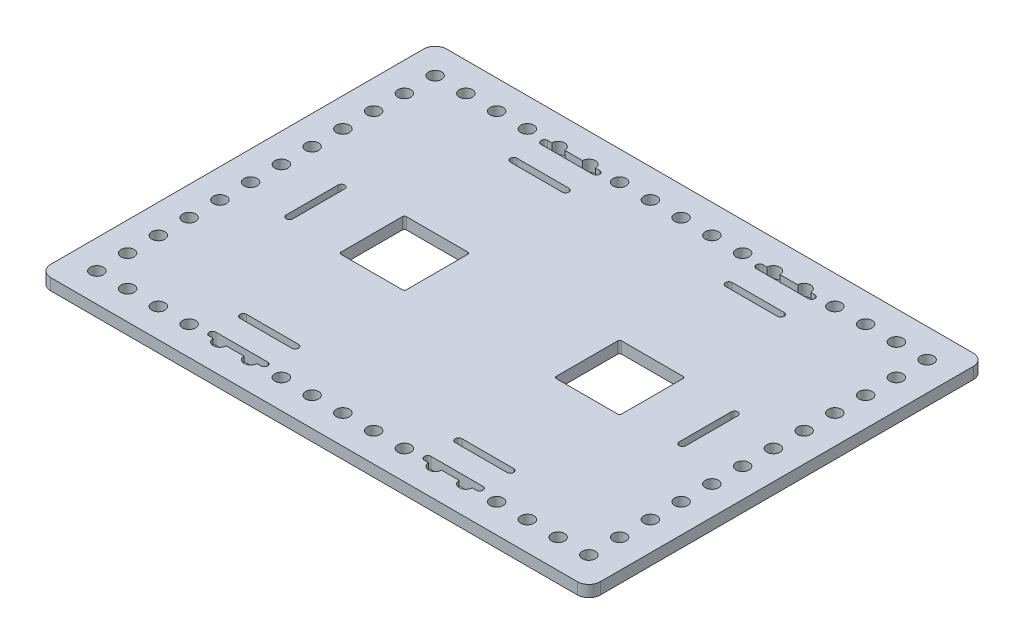
from build123d import *

# Parameters (mm, degrees)
SKETCH1_R           = 1.7
BOSS_EXTRUDE1_DEPTH = 3


with BuildPart() as part:
    # Sketch1 → Boss-Extrude1 (new body)
    with BuildSketch(Plane(origin=(0, 3, 0), x_dir=(1, 0, 0), z_dir=(0, 1, 0))):
        with BuildLine():
            Line((71.5, -48.5), (71.5, 48.5))
            ThreePointArc((71.5, 48.5), (70.621320344, 50.621320344), (68.5, 51.5))
            Line((68.5, 51.5), (-68.5, 51.5))
            ThreePointArc((-68.5, 51.5), (-70.621320344, 50.621320344), (-71.5, 48.5))
            Line((-71.5, 48.5), (-71.5, -48.5))
            ThreePointArc((-71.5, -48.5), (-70.621320344, -50.621320344), (-68.5, -51.5))
            Line((-68.5, -51.5), (68.5, -51.5))
            ThreePointArc((68.5, -51.5), (70.621320344, -50.621320344), (71.5, -48.5))
        make_face()
        with Locations(Location((-64, 44, 0), (0, 0, 90))):
            Circle(SKETCH1_R, mode=Mode.SUBTRACT)
        with Locations(Location((-64, 28, 0), (0, 0, 90))):
            Circle(SKETCH1_R, mode=Mode.SUBTRACT)
        with Locations(Location((-64, 12, 0), (0, 0, 90))):
            Circle(SKETCH1_R, mode=Mode.SUBTRACT)
        with Locations(Location((-64, -4, 0), (0, 0, 90))):
            Circle(SKETCH1_R, mode=Mode.SUBTRACT)
        with Locations(Location((-64, -20, 0), (0, 0, 90))):
            Circle(SKETCH1_R, mode=Mode.SUBTRACT)
        with Locations(Location((-64, -36, 0), (0, 0, 90))):
            Circle(SKETCH1_R, mode=Mode.SUBTRACT)
        with Locations(Location((56, -44, 0), (0, 0, 90))):
            Circle(SKETCH1_R, mode=Mode.SUBTRACT)
        with Locations(Location((40, -44, 0), (0, 0, 90))):
            Circle(SKETCH1_R, mode=Mode.SUBTRACT)
        with Locations(Location((8, -44, 0), (0, 0, 90))):
            Circle(SKETCH1_R, mode=Mode.SUBTRACT)
        with Locations(Location((-8, -44, 0), (0, 0, 90))):
            Circle(SKETCH1_R, mode=Mode.SUBTRACT)
        with Locations(Location((-40, -44, 0), (0, 0, 90))):
            Circle(SKETCH1_R, mode=Mode.SUBTRACT)
        with Locations(Location((-56, -44, 0), (0, 0, 90))):
            Circle(SKETCH1_R, mode=Mode.SUBTRACT)
        with Locations(Location((-64, -44, 0), (0, 0, 90))):
            Circle(SKETCH1_R, mode=Mode.SUBTRACT)
        with Locations(Location((-48, -44, 0), (0, 0, 90))):
            Circle(SKETCH1_R, mode=Mode.SUBTRACT)
        with Locations(Location((-16, -44, 0), (0, 0, 90))):
            Circle(SKETCH1_R, mode=Mode.SUBTRACT)
        with Locations(Location((0, -44, 0), (0, 0, 90))):
            Circle(SKETCH1_R, mode=Mode.SUBTRACT)
        with Locations(Location((16, -44, 0), (0, 0, 90))):
            Circle(SKETCH1_R, mode=Mode.SUBTRACT)
        with Locations(Location((48, -44, 0), (0, 0, 90))):
            Circle(SKETCH1_R, mode=Mode.SUBTRACT)
        with Locations(Location((64, -44, 0), (0, 0, 90))):
            Circle(SKETCH1_R, mode=Mode.SUBTRACT)
        with Locations(Location((-64, -28, 0), (0, 0, 90))):
            Circle(SKETCH1_R, mode=Mode.SUBTRACT)
        with Locations(Location((-64, -12, 0), (0, 0, 90))):
            Circle(SKETCH1_R, mode=Mode.SUBTRACT)
        with Locations(Location((-64, 4, 0), (0, 0, 90))):
            Circle(SKETCH1_R, mode=Mode.SUBTRACT)
        with Locations(Location((-64, 20, 0), (0, 0, 90))):
            Circle(SKETCH1_R, mode=Mode.SUBTRACT)
        with Locations(Location((-64, 36, 0), (0, 0, 90))):
            Circle(SKETCH1_R, mode=Mode.SUBTRACT)
        with Locations(Location((64, -20, 0), (0, 0, 90))):
            Circle(SKETCH1_R, mode=Mode.SUBTRACT)
        with Locations(Location((64, -4, 0), (0, 0, 90))):
            Circle(SKETCH1_R, mode=Mode.SUBTRACT)
        with Locations(Location((64, 12, 0), (0, 0, 90))):
            Circle(SKETCH1_R, mode=Mode.SUBTRACT)
        with Locations(Location((64, 28, 0), (0, 0, 90))):
            Circle(SKETCH1_R, mode=Mode.SUBTRACT)
        with Locations(Location((-48, 44, 0), (0, 0, 90))):
            Circle(SKETCH1_R, mode=Mode.SUBTRACT)
        with Locations(Location((-16, 44, 0), (0, 0, 90))):
            Circle(SKETCH1_R, mode=Mode.SUBTRACT)
        with Locations(Location((0, 44, 0), (0, 0, 90))):
            Circle(SKETCH1_R, mode=Mode.SUBTRACT)
        with Locations(Location((16, 44, 0), (0, 0, 90))):
            Circle(SKETCH1_R, mode=Mode.SUBTRACT)
        with Locations(Location((48, 44, 0), (0, 0, 90))):
            Circle(SKETCH1_R, mode=Mode.SUBTRACT)
        with Locations(Location((64, 44, 0), (0, 0, 90))):
            Circle(SKETCH1_R, mode=Mode.SUBTRACT)
        with Locations(Location((56, 44, 0), (0, 0, 90))):
            Circle(SKETCH1_R, mode=Mode.SUBTRACT)
        with Locations(Location((40, 44, 0), (0, 0, 90))):
            Circle(SKETCH1_R, mode=Mode.SUBTRACT)
        with Locations(Location((8, 44, 0), (0, 0, 90))):
            Circle(SKETCH1_R, mode=Mode.SUBTRACT)
        with Locations(Location((-8, 44, 0), (0, 0, 90))):
            Circle(SKETCH1_R, mode=Mode.SUBTRACT)
        with Locations(Location((-40, 44, 0), (0, 0, 90))):
            Circle(SKETCH1_R, mode=Mode.SUBTRACT)
        with Locations(Location((-56, 44, 0), (0, 0, 90))):
            Circle(SKETCH1_R, mode=Mode.SUBTRACT)
        with Locations(Location((64, 36, 0), (0, 0, 90))):
            Circle(SKETCH1_R, mode=Mode.SUBTRACT)
        with Locations(Location((64, 20, 0), (0, 0, 90))):
            Circle(SKETCH1_R, mode=Mode.SUBTRACT)
        with Locations(Location((64, 4, 0), (0, 0, 90))):
            Circle(SKETCH1_R, mode=Mode.SUBTRACT)
        with Locations(Location((64, -12, 0), (0, 0, 90))):
            Circle(SKETCH1_R, mode=Mode.SUBTRACT)
        with Locations(Location((64, -28, 0), (0, 0, 90))):
            Circle(SKETCH1_R, mode=Mode.SUBTRACT)
        with Locations(Location((64, -36, 0), (0, 0, 90))):
            Circle(SKETCH1_R, mode=Mode.SUBTRACT)
        with BuildLine():
            Line((21.25, 44.05), (22.300735453, 44.05))
            ThreePointArc((22.300735453, 44.05), (24, 45.7), (25.699264547, 44.05))
            Line((25.699264547, 44.05), (30.300735453, 44.05))
            ThreePointArc((30.300735453, 44.05), (32, 45.7), (33.699264547, 44.05))
            Line((33.699264547, 44.05), (34.75, 44.05))
            ThreePointArc((34.75, 44.05), (35.625, 43.175), (34.75, 42.3))
            Line((34.75, 42.3), (21.25, 42.3))
            ThreePointArc((21.25, 42.3), (20.375, 43.175), (21.25, 44.05))
        make_face(mode=Mode.SUBTRACT)
        with BuildLine():
            Line((22.300735453, -44.05), (21.25, -44.05))
            ThreePointArc((21.25, -44.05), (20.375, -43.175), (21.25, -42.3))
            Line((21.25, -42.3), (34.75, -42.3))
            ThreePointArc((34.75, -42.3), (35.625, -43.175), (34.75, -44.05))
            Line((34.75, -44.05), (33.699264547, -44.05))
            ThreePointArc((33.699264547, -44.05), (32, -45.7), (30.300735453, -44.05))
            Line((30.300735453, -44.05), (25.699264547, -44.05))
            ThreePointArc((25.699264547, -44.05), (24, -45.7), (22.300735453, -44.05))
        make_face(mode=Mode.SUBTRACT)
        with BuildLine():
            Line((21.25, 36.05), (34.75, 36.05))
            ThreePointArc((34.75, 36.05), (35.625, 35.175), (34.75, 34.3))
            Line((34.75, 34.3), (21.25, 34.3))
            ThreePointArc((21.25, 34.3), (20.375, 35.175), (21.25, 36.05))
        make_face(mode=Mode.SUBTRACT)
        with BuildLine():
            Line((50.25, -6.75), (50.25, 6.75))
            ThreePointArc((50.25, 6.75), (51.125, 7.625), (52, 6.75))
            Line((52, 6.75), (52, -6.75))
            ThreePointArc((52, -6.75), (51.125, -7.625), (50.25, -6.75))
        make_face(mode=Mode.SUBTRACT)
        with BuildLine():
            Line((21.25, -34.3), (34.75, -34.3))
            ThreePointArc((34.75, -34.3), (35.625, -35.175), (34.75, -36.05))
            Line((34.75, -36.05), (21.25, -36.05))
            ThreePointArc((21.25, -36.05), (20.375, -35.175), (21.25, -34.3))
        make_face(mode=Mode.SUBTRACT)
        with BuildLine():
            Line((36, -8.5), (20, -8.5))
            ThreePointArc((20, -8.5), (19.646446609, -8.353553391), (19.5, -8))
            Line((19.5, -8), (19.5, 8))
            ThreePointArc((19.5, 8), (19.646446609, 8.353553391), (20, 8.5))
            Line((20, 8.5), (36, 8.5))
            ThreePointArc((36, 8.5), (36.353553391, 8.353553391), (36.5, 8))
            Line((36.5, 8), (36.5, -8))
            ThreePointArc((36.5, -8), (36.353553391, -8.353553391), (36, -8.5))
        make_face(mode=Mode.SUBTRACT)
        with BuildLine():
            Line((-21.25, 34.3), (-34.75, 34.3))
            ThreePointArc((-34.75, 34.3), (-35.625, 35.175), (-34.75, 36.05))
            Line((-34.75, 36.05), (-21.25, 36.05))
            ThreePointArc((-21.25, 36.05), (-20.375, 35.175), (-21.25, 34.3))
        make_face(mode=Mode.SUBTRACT)
        with BuildLine():
            Line((-50.25, 6.75), (-50.25, -6.75))
            ThreePointArc((-50.25, -6.75), (-51.125, -7.625), (-52, -6.75))
            Line((-52, -6.75), (-52, 6.75))
            ThreePointArc((-52, 6.75), (-51.125, 7.625), (-50.25, 6.75))
        make_face(mode=Mode.SUBTRACT)
        with BuildLine():
            Line((-21.25, -36.05), (-34.75, -36.05))
            ThreePointArc((-34.75, -36.05), (-35.625, -35.175), (-34.75, -34.3))
            Line((-34.75, -34.3), (-21.25, -34.3))
            ThreePointArc((-21.25, -34.3), (-20.375, -35.175), (-21.25, -36.05))
        make_face(mode=Mode.SUBTRACT)
        with BuildLine():
            Line((-19.5, 8), (-19.5, -8))
            ThreePointArc((-19.5, -8), (-19.646446609, -8.353553391), (-20, -8.5))
            Line((-20, -8.5), (-36, -8.5))
            ThreePointArc((-36, -8.5), (-36.353553391, -8.353553391), (-36.5, -8))
            Line((-36.5, -8), (-36.5, 8))
            ThreePointArc((-36.5, 8), (-36.353553391, 8.353553391), (-36, 8.5))
            Line((-36, 8.5), (-20, 8.5))
            ThreePointArc((-20, 8.5), (-19.646446609, 8.353553391), (-19.5, 8))
        make_face(mode=Mode.SUBTRACT)
        with BuildLine():
            Line((-34.75, -42.3), (-21.25, -42.3))
            ThreePointArc((-21.25, -42.3), (-20.375, -43.175), (-21.25, -44.05))
            Line((-21.25, -44.05), (-22.300735453, -44.05))
            ThreePointArc((-22.300735453, -44.05), (-24, -45.7), (-25.699264547, -44.05))
            Line((-25.699264547, -44.05), (-30.300735453, -44.05))
            ThreePointArc((-30.300735453, -44.05), (-32, -45.7), (-33.699264547, -44.05))
            Line((-33.699264547, -44.05), (-34.75, -44.05))
            ThreePointArc((-34.75, -44.05), (-35.625, -43.175), (-34.75, -42.3))
        make_face(mode=Mode.SUBTRACT)
        with BuildLine():
            Line((-34.75, 44.05), (-33.699264547, 44.05))
            ThreePointArc((-33.699264547, 44.05), (-32, 45.7), (-30.300735453, 44.05))
            Line((-30.300735453, 44.05), (-25.699264547, 44.05))
            ThreePointArc((-25.699264547, 44.05), (-24, 45.7), (-22.300735453, 44.05))
            Line((-22.300735453, 44.05), (-21.25, 44.05))
            ThreePointArc((-21.25, 44.05), (-20.375, 43.175), (-21.25, 42.3))
            Line((-21.25, 42.3), (-34.75, 42.3))
            ThreePointArc((-34.75, 42.3), (-35.625, 43.175), (-34.75, 44.05))
        make_face(mode=Mode.SUBTRACT)
    extrude(amount=-BOSS_EXTRUDE1_DEPTH)


solid = part.part
